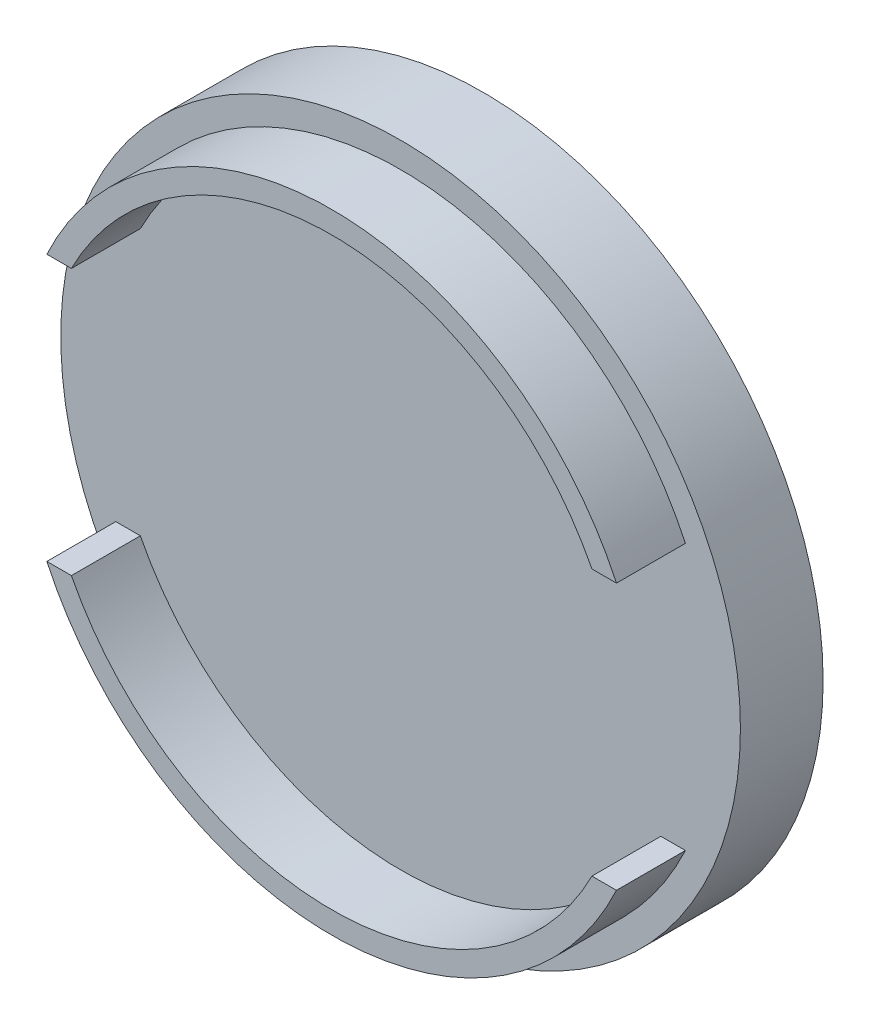
from build123d import *

# Parameters (mm, degrees)
SKETCH1_R           = 24.65
BOSS_EXTRUDE1_DEPTH = 6
SKETCH2_R           = 22.8
SKETCH2_R_2         = 21.2
BOSS_EXTRUDE2_DEPTH = 5
CUT_EXTRUDE1_START  = -5
CUT_EXTRUDE1_DEPTH  = 5


with BuildPart() as part:
    # Sketch1 → Boss-Extrude1 (new body)
    with BuildSketch(Plane.XY):
        Circle(SKETCH1_R)
    extrude(amount=BOSS_EXTRUDE1_DEPTH)

    # Sketch2 → Boss-Extrude2 (add)
    with BuildSketch(Plane.XY.offset(6)):
        Circle(SKETCH2_R)
        Circle(SKETCH2_R_2, mode=Mode.SUBTRACT)
    extrude(amount=BOSS_EXTRUDE2_DEPTH)

    # Sketch3 → Cut-Extrude1 (cut)
    with BuildSketch(Plane.XY.offset(11).offset(CUT_EXTRUDE1_START)):
        with BuildLine():
            Line((-20.658461767, 9.647173545), (-18.877818798, 9.647173545))
            ThreePointArc((-18.877818798, 9.647173545), (-21.2, 0), (-18.877818798, -9.647173545))
            Line((-18.877818798, -9.647173545), (-20.658461767, -9.647173545))
            ThreePointArc((-20.658461767, -9.647173545), (-22.8, 0), (-20.658461767, 9.647173545))
        make_face()
        with BuildLine():
            Line((20.658461767, -9.647173545), (18.877818798, -9.647173545))
            ThreePointArc((18.877818798, -9.647173545), (21.2, 0), (18.877818798, 9.647173545))
            Line((18.877818798, 9.647173545), (20.658461767, 9.647173545))
            ThreePointArc((20.658461767, 9.647173545), (22.8, 0), (20.658461767, -9.647173545))
        make_face()
    extrude(amount=CUT_EXTRUDE1_DEPTH, mode=Mode.SUBTRACT)


solid = part.part
